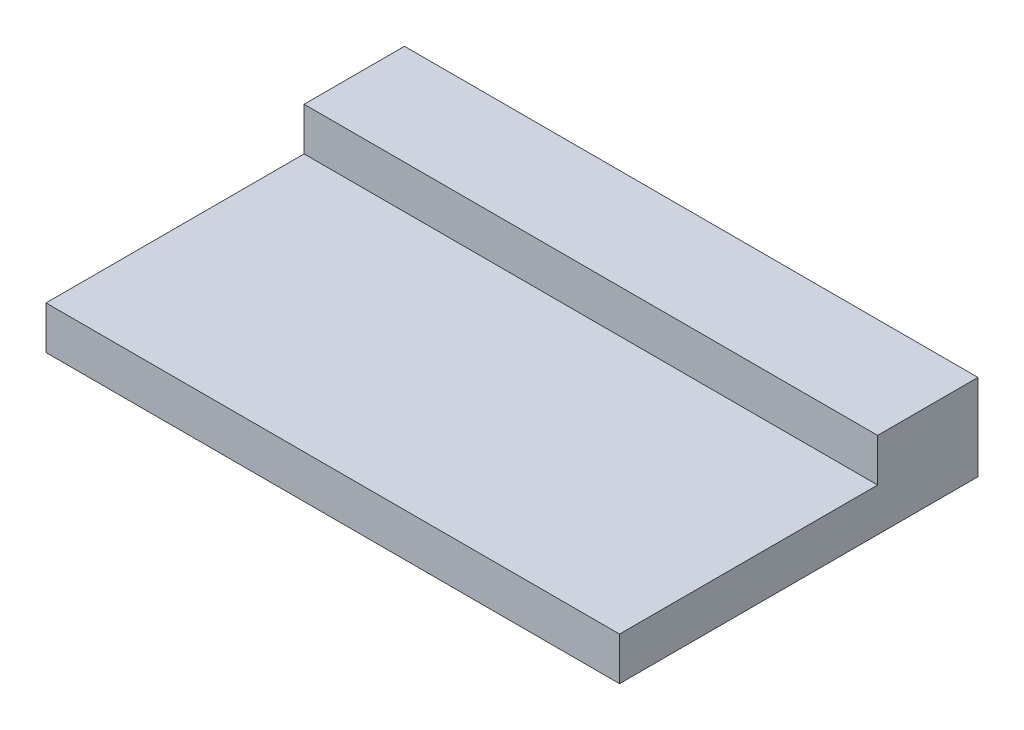
from build123d import *

# Parameters (mm, degrees)
SKETCH1_W           = 40
SKETCH1_H           = 25
BOSS_EXTRUDE1_DEPTH = 3
SKETCH2_W           = 40
SKETCH2_H           = 7
BOSS_EXTRUDE2_DEPTH = 3


with BuildPart() as part:
    # Sketch1 → Boss-Extrude1 (new body)
    with BuildSketch(Plane(origin=(0, 0, 0), x_dir=(1, 0, 0), z_dir=(0, 1, 0))):
        with Locations((20, 12.5)):
            Rectangle(SKETCH1_W, SKETCH1_H)
    extrude(amount=BOSS_EXTRUDE1_DEPTH)

    # Sketch2 → Boss-Extrude2 (add)
    with BuildSketch(Plane(origin=(0, 3, 0), x_dir=(1, 0, 0), z_dir=(0, 1, 0))):
        with Locations((20, 21.5)):
            Rectangle(SKETCH2_W, SKETCH2_H)
    extrude(amount=BOSS_EXTRUDE2_DEPTH)


solid = part.part
